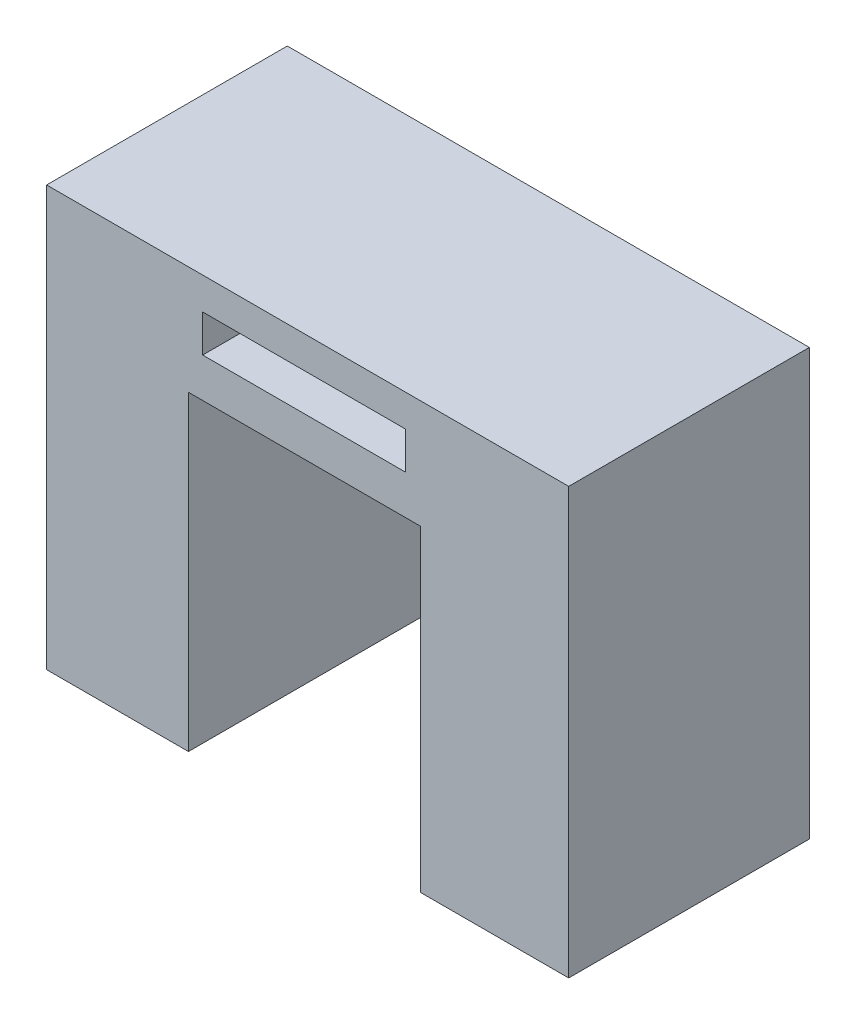
from build123d import *

# Parameters (mm, degrees)
SKETCH1_W           = 76.595992709
SKETCH1_H           = 226.770325479
SKETCH1_W_2         = 125.310344828
SKETCH1_H_2         = 58.689655172
SKETCH1_W_3         = 80.103448276
SKETCH1_H_3         = 230
BOSS_EXTRUDE1_DEPTH = 130
SKETCH3_W           = 109.68672873
SKETCH3_H           = 20.160489082
CUT_EXTRUDE1_DEPTH  = 100
SKETCH7_W           = 108.256911282
SKETCH7_H           = 50
CUT_EXTRUDE3_DEPTH  = 40


with BuildPart() as part:
    # Sketch1 → Boss-Extrude1 (new body)
    with BuildSketch(Plane.XY):
        with Locations((-163.608341182, -20.592059291)):
            Rectangle(SKETCH1_W, SKETCH1_H)
        with Locations((-62.655172414, 63.448275862)):
            Rectangle(SKETCH1_W_2, SKETCH1_H_2)
        with Locations((40.051724138, -22.206896552)):
            Rectangle(SKETCH1_W_3, SKETCH1_H_3)
    extrude(amount=BOSS_EXTRUDE1_DEPTH)

    # Sketch3 → Cut-Extrude1 (cut)
    with BuildSketch(Plane.XY.offset(130)):
        with Locations((-62.780812257, 65.439975471)):
            Rectangle(SKETCH3_W, SKETCH3_H)
    extrude(amount=-CUT_EXTRUDE1_DEPTH, mode=Mode.SUBTRACT)

    # Sketch7 → Cut-Extrude3 (cut)
    with BuildSketch(Plane(origin=(0, 34.103448276, 0), x_dir=(-1, 0, 0), z_dir=(0, -1, 0))):
        with Locations((63.495720981, -64.04122146)):
            Rectangle(SKETCH7_W, SKETCH7_H)
    extrude(amount=-CUT_EXTRUDE3_DEPTH, mode=Mode.SUBTRACT)


solid = part.part
